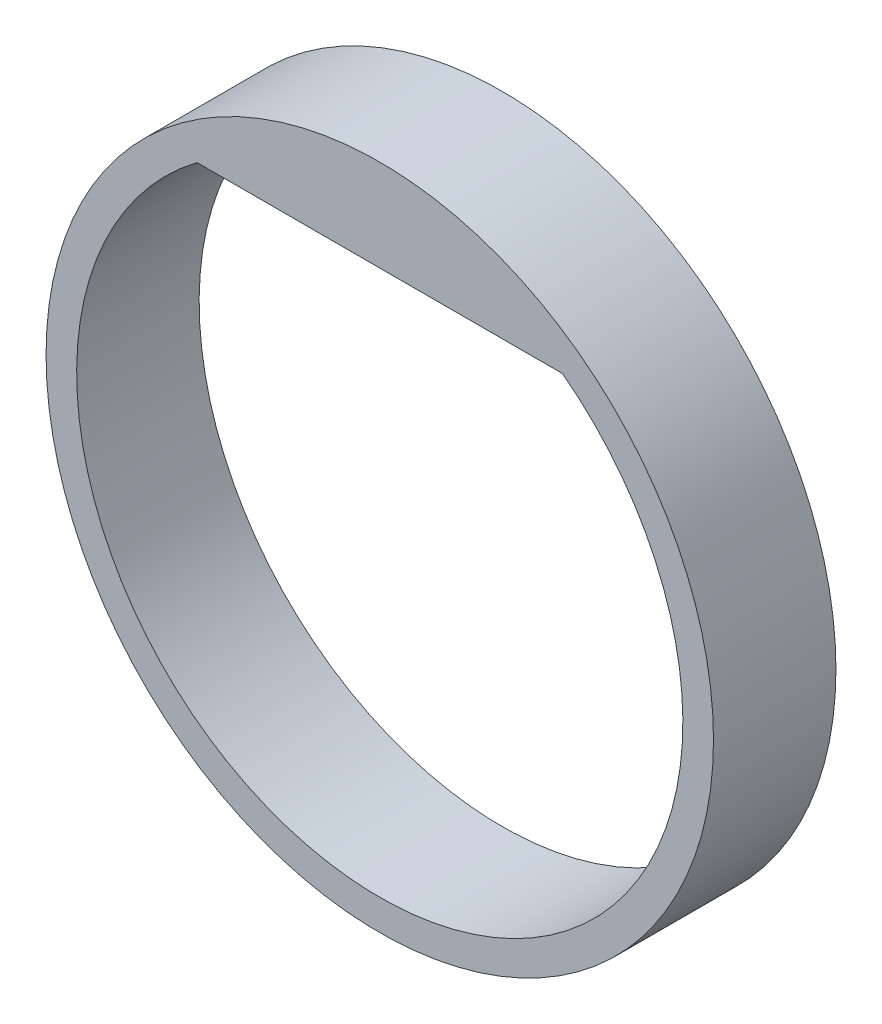
from build123d import *

# Parameters (mm, degrees)
SKIZZE1_R                       = 5.45
AUFSATZ_LINEAR_AUSTRAGEN1_DEPTH = 2


with BuildPart() as part:
    # Skizze1 → Aufsatz-Linear austragen1 (new body)
    with BuildSketch(Plane.XY):
        Circle(SKIZZE1_R)
        with BuildLine():
            Line((2.983286778, 3.95), (-2.983286778, 3.95))
            ThreePointArc((-2.983286778, 3.95), (0, -4.95), (2.983286778, 3.95))
        make_face(mode=Mode.SUBTRACT)
    extrude(amount=AUFSATZ_LINEAR_AUSTRAGEN1_DEPTH)


solid = part.part
